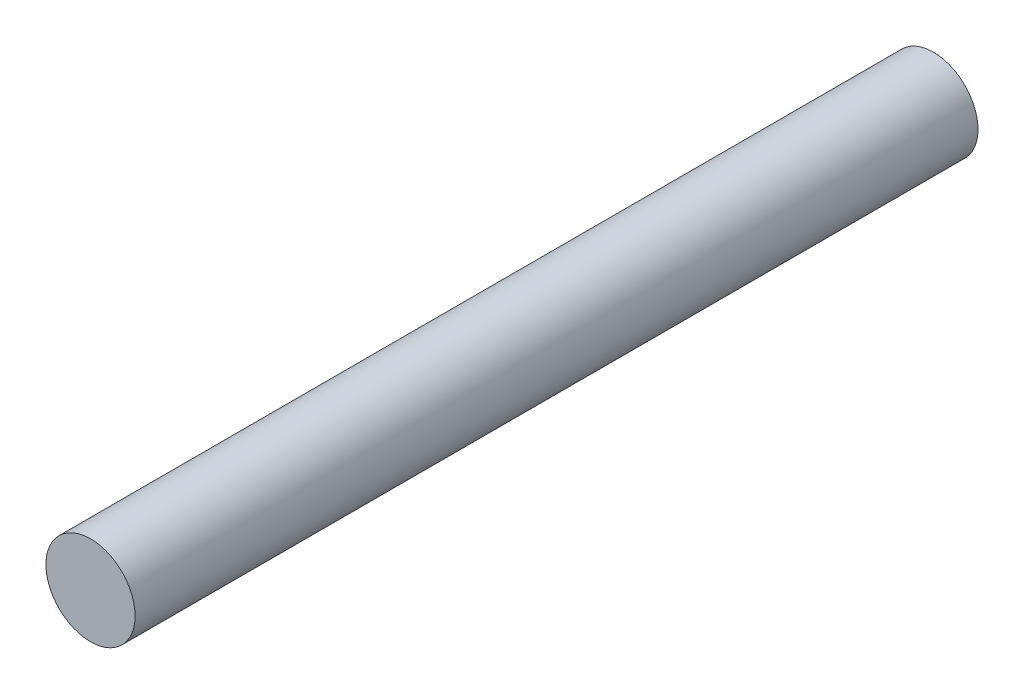
from build123d import *

# Parameters (mm, degrees)
SKETCH2_R           = 12.7
BOSS_EXTRUDE1_DEPTH = 120


with BuildPart() as part:
    # Sketch2 → Boss-Extrude1 (new, symmetric)
    with BuildSketch(Plane.XY):
        Circle(SKETCH2_R)
    extrude(amount=BOSS_EXTRUDE1_DEPTH, both=True)


solid = part.part
